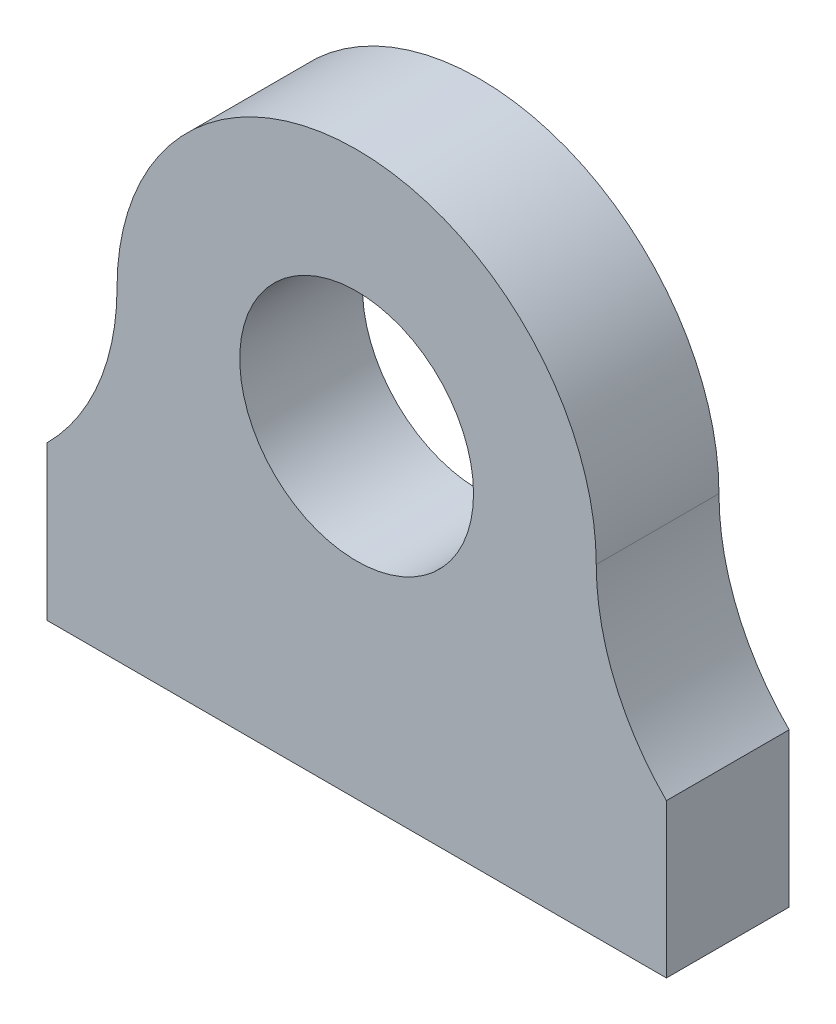
from build123d import *

# Parameters (mm, degrees)
SKETCH1_R           = 4.7625
BOSS_EXTRUDE1_DEPTH = 5


with BuildPart() as part:
    # Sketch1 → Boss-Extrude1 (new body)
    with BuildSketch(Plane.XY):
        with BuildLine():
            Line((-11.599180508, 2.297223602), (-11.599180508, -0.562353553))
            Line((-11.599180508, -0.562353553), (-11.599180508, -3.961142474))
            Line((-11.599180508, -3.961142474), (13.644266696, -3.961142474))
            Line((13.644266696, -3.961142474), (13.644266696, -0.562353553))
            Line((13.644266696, -0.562353553), (13.644266696, 2.297223602))
            ThreePointArc((13.644266696, 2.297223602), (11.528131098, 5.464244333), (10.785043094, 9.2))
            ThreePointArc((10.785043094, 9.2), (1.022543094, 18.9625), (-8.739956906, 9.2))
            ThreePointArc((-8.739956906, 9.2), (-9.48304491, 5.464244333), (-11.599180508, 2.297223602))
        make_face()
        with Locations((1.022543094, 9.2)):
            Circle(SKETCH1_R, mode=Mode.SUBTRACT)
    extrude(amount=BOSS_EXTRUDE1_DEPTH)


solid = part.part
